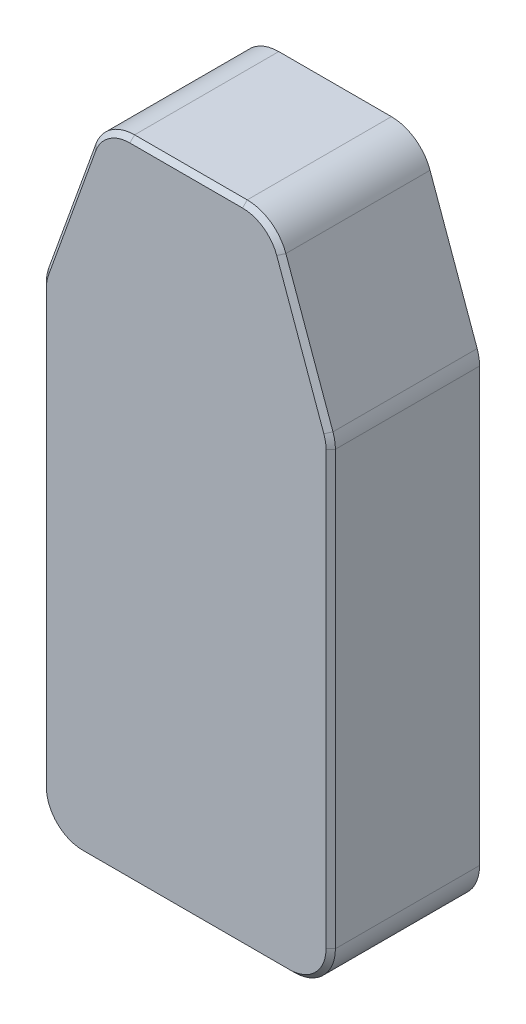
from build123d import *

# Parameters (mm, degrees)
BOSS_EXTRUDE1_DEPTH = 46
BOSS_EXTRUDE2_DEPTH = 1.5
CHAMFER1_SIZE       = 1.5


with BuildPart() as part:
    # Sketch1 → Boss-Extrude1 (new body)
    with BuildSketch(Plane.XY):
        with BuildLine():
            Line((-30.297360891, 123.437225034), (-45.325625095, 81.692046689))
            ThreePointArc((-45.325625095, 81.692046689), (-45.904954257, 79.506966326), (-46.1, 77.254821654))
            Line((-46.1, 77.254821654), (-46.1, -60.733642247))
            ThreePointArc((-46.1, -60.733642247), (-42.263098834, -69.99674108), (-33, -73.833642247))
            Line((-33, -73.833642247), (33, -73.833642247))
            ThreePointArc((33, -73.833642247), (42.263098834, -69.99674108), (46.1, -60.733642247))
            Line((46.1, -60.733642247), (46.1, 77.254821654))
            ThreePointArc((46.1, 77.254821654), (45.904954257, 79.506966326), (45.325625095, 81.692046689))
            Line((45.325625095, 81.692046689), (30.297360891, 123.437225034))
            ThreePointArc((30.297360891, 123.437225034), (25.504409692, 129.717687436), (17.971735796, 132.1))
            Line((17.971735796, 132.1), (-17.971735796, 132.1))
            ThreePointArc((-17.971735796, 132.1), (-25.504409692, 129.717687436), (-30.297360891, 123.437225034))
        make_face()
        with BuildLine():
            Line((-27.474698655, 122.42106663), (-42.50296286, 80.675888284))
            ThreePointArc((-42.50296286, 80.675888284), (-42.949621221, 78.991208005), (-43.1, 77.254821654))
            Line((-43.1, 77.254821654), (-43.1, -60.733642247))
            ThreePointArc((-43.1, -60.733642247), (-40.14177849, -67.875420737), (-33, -70.833642247))
            Line((-33, -70.833642247), (33, -70.833642247))
            ThreePointArc((33, -70.833642247), (40.14177849, -67.875420737), (43.1, -60.733642247))
            Line((43.1, -60.733642247), (43.1, 77.254821654))
            ThreePointArc((43.1, 77.254821654), (42.949621221, 78.991208005), (42.50296286, 80.675888284))
            Line((42.50296286, 80.675888284), (27.474698655, 122.42106663))
            ThreePointArc((27.474698655, 122.42106663), (23.779369868, 127.263255199), (17.971735796, 129.1))
            Line((17.971735796, 129.1), (-17.971735796, 129.1))
            ThreePointArc((-17.971735796, 129.1), (-23.779369868, 127.263255199), (-27.474698655, 122.42106663))
        make_face(mode=Mode.SUBTRACT)
    extrude(amount=BOSS_EXTRUDE1_DEPTH)

    # Sketch2 → Boss-Extrude2 (add)
    with BuildSketch(Plane.XY.offset(46)):
        with BuildLine():
            Line((17.971735796, 132.1), (-17.971735796, 132.1))
            ThreePointArc((-17.971735796, 132.1), (-25.504409692, 129.717687436), (-30.297360891, 123.437225034))
            Line((-30.297360891, 123.437225034), (-45.325625095, 81.692046689))
            ThreePointArc((-45.325625095, 81.692046689), (-45.904954257, 79.506966326), (-46.1, 77.254821654))
            Line((-46.1, 77.254821654), (-46.1, -60.733642247))
            ThreePointArc((-46.1, -60.733642247), (-42.263098834, -69.99674108), (-33, -73.833642247))
            Line((-33, -73.833642247), (33, -73.833642247))
            ThreePointArc((33, -73.833642247), (42.263098834, -69.99674108), (46.1, -60.733642247))
            Line((46.1, -60.733642247), (46.1, 77.254821654))
            ThreePointArc((46.1, 77.254821654), (45.904954257, 79.506966326), (45.325625095, 81.692046689))
            Line((45.325625095, 81.692046689), (30.297360891, 123.437225034))
            ThreePointArc((30.297360891, 123.437225034), (25.504409692, 129.717687436), (17.971735796, 132.1))
        make_face()
    extrude(amount=BOSS_EXTRUDE2_DEPTH)

    # Chamfer1
    chamfer1_edges = [part.edges().sort_by_distance(p)[0] for p in [
        (-23.779369868, 127.263255199, 0),
        (-34.988830758, 101.548477457, 0),
        (-42.949621221, 78.991208005, 0),
        (-43.1, 8.260589704, 0),
        (-40.14177849, -67.875420737, 0),
        (0, -70.833642247, 0),
        (40.14177849, -67.875420737, 0),
        (43.1, 8.260589704, 0),
        (42.949621221, 78.991208005, 0),
        (34.988830758, 101.548477457, 0),
        (23.779369868, 127.263255199, 0),
        (0, 129.1, 0),
        (25.504409692, 129.717687436, 47.5),
        (0, 132.1, 47.5),
        (-25.504409692, 129.717687436, 47.5),
        (-37.811492993, 102.564635861, 47.5),
        (-45.904954257, 79.506966326, 47.5),
        (-46.1, 8.260589704, 47.5),
        (-42.263098834, -69.99674108, 47.5),
        (0, -73.833642247, 47.5),
        (42.263098834, -69.99674108, 47.5),
        (46.1, 8.260589704, 47.5),
        (45.904954257, 79.506966326, 47.5),
        (37.811492993, 102.564635861, 47.5),
    ]]
    chamfer(chamfer1_edges, length=CHAMFER1_SIZE)


solid = part.part
